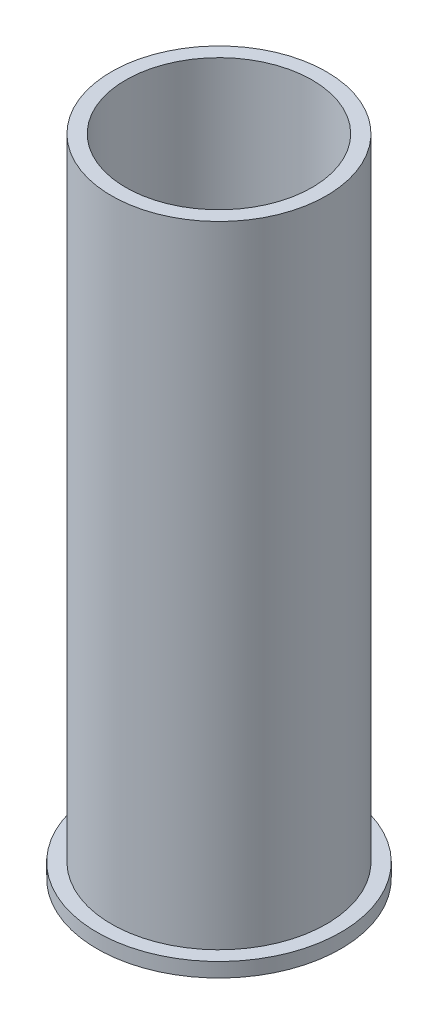
from build123d import *


with BuildPart() as part:
    # Sketch1 → Revolve1 (revolve)
    with BuildSketch(Plane.XY, mode=Mode.PRIVATE) as revolve1_sk:
        Polygon((32.5, -163.860978422), (32.5, 61.139021578), (37.5, 61.139021578), (37.5, -158.860978422), (42.5, -158.860978422), (42.5, -163.860978422), (37.5, -163.860978422), align=None)
    revolve(revolve1_sk.sketch.rotate(Axis((0, 0, 0), (0, 1, 0)), 90), axis=Axis((0, 0, 0), (0, 1, 0)))


solid = part.part
